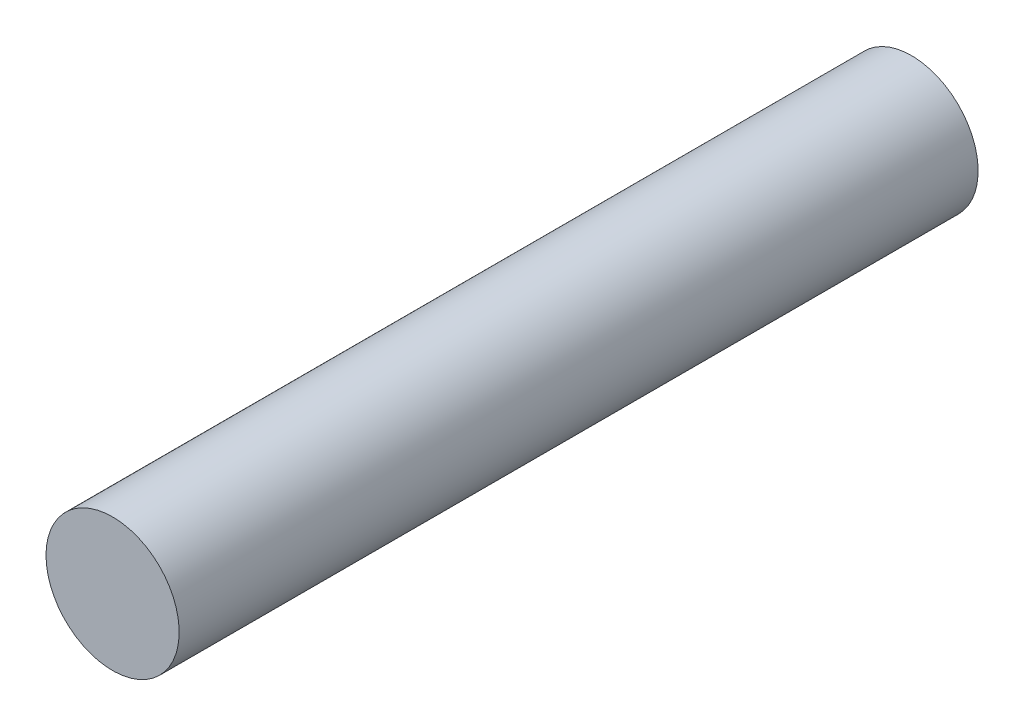
from build123d import *

# Parameters (mm, degrees)
ESQUISSE1_R        = 6.35
BOSS_EXTRU_1_DEPTH = 76.2


with BuildPart() as part:
    # Esquisse1 → Boss.-Extru.1 (new body)
    with BuildSketch(Plane.XY):
        with Locations(Location((0, 0, 0), (0, 0, 180))):
            Circle(ESQUISSE1_R)
    extrude(amount=BOSS_EXTRU_1_DEPTH)


solid = part.part
